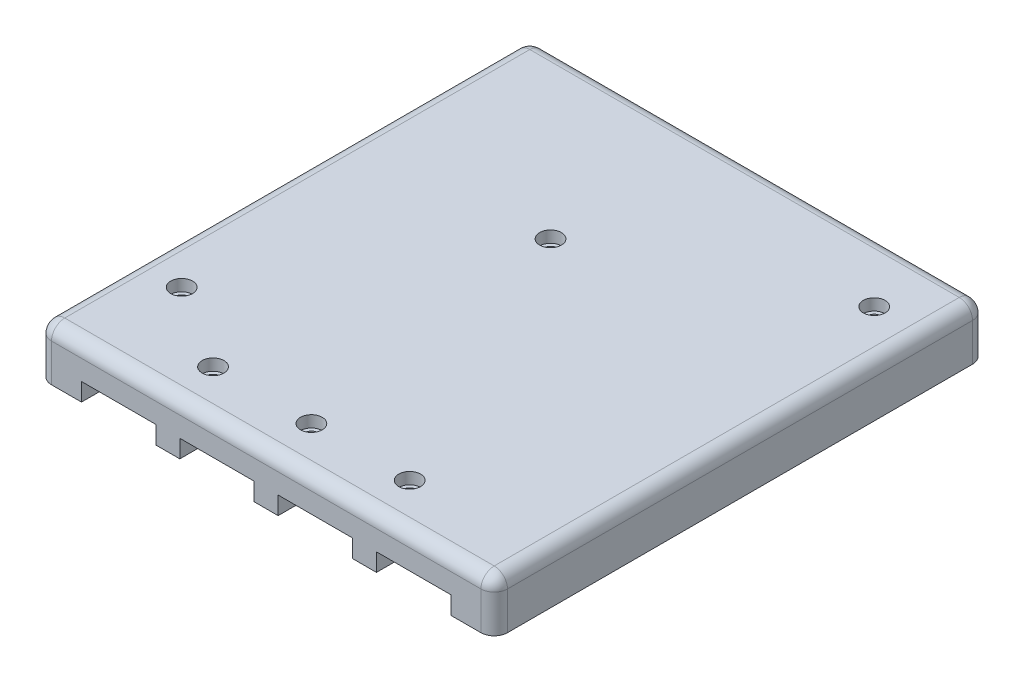
from build123d import *

# Parameters (mm, degrees)
SKETCH1_W           = 85.8
SKETCH1_H           = 92.5
SKETCH1_R           = 2.05
BOSS_EXTRUDE1_DEPTH = 3.175
SKETCH2_W           = 85.8
SKETCH2_H           = 92.5
SKETCH2_R           = 1.35
SKETCH2_R_2         = 3.35
BOSS_EXTRUDE2_DEPTH = 1.905
BOSS_EXTRUDE3_START = 1
SKETCH2_3_W         = 85.8
SKETCH2_3_H         = 92.5
SKETCH2_3_R         = 1.35
SKETCH2_3_R_2       = 3.35
BOSS_EXTRUDE3_DEPTH = 1
SKETCH3_W           = 85.8
SKETCH3_H           = 92.5
SKETCH3_W_2         = 75.8
SKETCH3_H_2         = 82.5
BOSS_EXTRUDE4_DEPTH = 4.55
SKETCH4_W           = 14
SKETCH4_H           = 6.75
CUT_EXTRUDE1_DEPTH  = 118.864146478
SKETCH5_W           = 10
SKETCH5_H           = 6
CUT_EXTRUDE2_DEPTH  = 118.864146478
BOSS_EXTRUDE5_DEPTH = 5
FILLET1_R           = 2.5
FILLET2_R           = 2.5
FILLET3_R           = 2.5
FILLET4_R           = 2.5
FILLET5_R           = 2.5


with BuildPart() as part:
    # Sketch1 → Boss-Extrude1 (new body)
    with BuildSketch(Plane(origin=(0, 0, 0), x_dir=(1, 0, 0), z_dir=(0, 1, 0))):
        with Locations((36.9, 40.25)):
            Rectangle(SKETCH1_W, SKETCH1_H)
        with Locations((2.5, 12.5)):
            Circle(SKETCH1_R, mode=Mode.SUBTRACT)
        with Locations((18.4, 2.5)):
            Circle(SKETCH1_R, mode=Mode.SUBTRACT)
        with Locations((36.9, 2.5)):
            Circle(SKETCH1_R, mode=Mode.SUBTRACT)
        with Locations((55.4, 2.5)):
            Circle(SKETCH1_R, mode=Mode.SUBTRACT)
        with Locations((29.3, 55.1)):
            Circle(SKETCH1_R, mode=Mode.SUBTRACT)
        with Locations((70.8, 74.5)):
            Circle(SKETCH1_R, mode=Mode.SUBTRACT)
    extrude(amount=BOSS_EXTRUDE1_DEPTH)

    # Sketch2 → Boss-Extrude2 (add)
    # profile 1 of 2: a face of its own
    with BuildSketch(Plane(origin=(0, 0, 0), x_dir=(1, 0, 0), z_dir=(0, 1, 0))):
        with Locations((36.9, 40.25)):
            Rectangle(SKETCH2_W, SKETCH2_H)
        with Locations((2.5, 12.5)):
            Circle(SKETCH2_R, mode=Mode.SUBTRACT)
        with Locations((18.4, 2.5)):
            Circle(SKETCH2_R, mode=Mode.SUBTRACT)
        with Locations((36.9, 2.5)):
            Circle(SKETCH2_R, mode=Mode.SUBTRACT)
        with Locations((55.4, 2.5)):
            Circle(SKETCH2_R, mode=Mode.SUBTRACT)
        with BuildLine():
            Line((-1, 7.5), (2.5, 7.5))
            ThreePointArc((2.5, 7.5), (7.5, 12.5), (2.5, 17.5))
            Line((2.5, 17.5), (-1, 17.5))
            Line((-1, 17.5), (-1, 81.5))
            Line((-1, 81.5), (65.8, 81.5))
            Line((65.8, 81.5), (65.8, 74.5))
            ThreePointArc((65.8, 74.5), (67.264466094, 70.964466094), (70.8, 69.5))
            Line((70.8, 69.5), (74.8, 69.5))
            Line((74.8, 69.5), (74.8, -1))
            Line((74.8, -1), (60.4, -1))
            Line((60.4, -1), (60.4, 2.5))
            ThreePointArc((60.4, 2.5), (55.4, 7.5), (50.4, 2.5))
            Line((50.4, 2.5), (50.4, -1))
            Line((50.4, -1), (41.9, -1))
            Line((41.9, -1), (41.9, 2.5))
            ThreePointArc((41.9, 2.5), (36.9, 7.5), (31.9, 2.5))
            Line((31.9, 2.5), (31.9, -1))
            Line((31.9, -1), (23.4, -1))
            Line((23.4, -1), (23.4, 2.5))
            ThreePointArc((23.4, 2.5), (18.4, 7.5), (13.4, 2.5))
            Line((13.4, 2.5), (13.4, -1))
            Line((13.4, -1), (-1, -1))
            Line((-1, -1), (-1, 7.5))
        make_face(mode=Mode.SUBTRACT)
        with Locations((70.8, 74.5)):
            Circle(SKETCH2_R, mode=Mode.SUBTRACT)
    # profile 2 of 2: a face of its own
    with BuildSketch(Plane(origin=(0, 0, 0), x_dir=(1, 0, 0), z_dir=(0, 1, 0))):
        with Locations((29.3, 55.1)):
            Circle(SKETCH2_R_2)
        with Locations((29.3, 55.1)):
            Circle(SKETCH2_R, mode=Mode.SUBTRACT)
    extrude(amount=-BOSS_EXTRUDE2_DEPTH)

    # Sketch2<3> → Boss-Extrude3 (add)
    # profile 1 of 2: a face of its own
    with BuildSketch(Plane(origin=(0, 0, 0), x_dir=(1, 0, 0), z_dir=(0, 1, 0)).offset(BOSS_EXTRUDE3_START)):
        with Locations((36.9, 40.25)):
            Rectangle(SKETCH2_3_W, SKETCH2_3_H)
        with Locations((2.5, 12.5)):
            Circle(SKETCH2_3_R, mode=Mode.SUBTRACT)
        with Locations((18.4, 2.5)):
            Circle(SKETCH2_3_R, mode=Mode.SUBTRACT)
        with Locations((36.9, 2.5)):
            Circle(SKETCH2_3_R, mode=Mode.SUBTRACT)
        with Locations((55.4, 2.5)):
            Circle(SKETCH2_3_R, mode=Mode.SUBTRACT)
        with BuildLine():
            Line((-1, 7.5), (2.5, 7.5))
            ThreePointArc((2.5, 7.5), (7.5, 12.5), (2.5, 17.5))
            Line((2.5, 17.5), (-1, 17.5))
            Line((-1, 17.5), (-1, 81.5))
            Line((-1, 81.5), (65.8, 81.5))
            Line((65.8, 81.5), (65.8, 74.5))
            ThreePointArc((65.8, 74.5), (67.264466094, 70.964466094), (70.8, 69.5))
            Line((70.8, 69.5), (74.8, 69.5))
            Line((74.8, 69.5), (74.8, -1))
            Line((74.8, -1), (60.4, -1))
            Line((60.4, -1), (60.4, 2.5))
            ThreePointArc((60.4, 2.5), (55.4, 7.5), (50.4, 2.5))
            Line((50.4, 2.5), (50.4, -1))
            Line((50.4, -1), (41.9, -1))
            Line((41.9, -1), (41.9, 2.5))
            ThreePointArc((41.9, 2.5), (36.9, 7.5), (31.9, 2.5))
            Line((31.9, 2.5), (31.9, -1))
            Line((31.9, -1), (23.4, -1))
            Line((23.4, -1), (23.4, 2.5))
            ThreePointArc((23.4, 2.5), (18.4, 7.5), (13.4, 2.5))
            Line((13.4, 2.5), (13.4, -1))
            Line((13.4, -1), (-1, -1))
            Line((-1, -1), (-1, 7.5))
        make_face(mode=Mode.SUBTRACT)
        with Locations((70.8, 74.5)):
            Circle(SKETCH2_3_R, mode=Mode.SUBTRACT)
    # profile 2 of 2: a face of its own
    with BuildSketch(Plane(origin=(0, 0, 0), x_dir=(1, 0, 0), z_dir=(0, 1, 0)).offset(BOSS_EXTRUDE3_START)):
        with Locations((29.3, 55.1)):
            Circle(SKETCH2_3_R_2)
        with Locations((29.3, 55.1)):
            Circle(SKETCH2_3_R, mode=Mode.SUBTRACT)
    extrude(amount=-BOSS_EXTRUDE3_DEPTH)

    # Sketch3 → Boss-Extrude4 (add)
    with BuildSketch(Plane(origin=(0, -1.905, 0), x_dir=(-1, 0, 0), z_dir=(0, -1, 0))):
        with Locations((-36.9, 40.25)):
            Rectangle(SKETCH3_W, SKETCH3_H)
        with Locations((-36.9, 40.25)):
            Rectangle(SKETCH3_W_2, SKETCH3_H_2, mode=Mode.SUBTRACT)
    extrude(amount=BOSS_EXTRUDE4_DEPTH)

    # Sketch4 → Cut-Extrude1 (cut, through all)
    with BuildSketch(Plane.XY):
        with Locations((9.15, -6.47)):
            Rectangle(SKETCH4_W, SKETCH4_H)
        with Locations((27.65, -6.47)):
            Rectangle(SKETCH4_W, SKETCH4_H)
        with Locations((46.15, -6.47)):
            Rectangle(SKETCH4_W, SKETCH4_H)
        with Locations((64.65, -6.47)):
            Rectangle(SKETCH4_W, SKETCH4_H)
    extrude(amount=CUT_EXTRUDE1_DEPTH, mode=Mode.SUBTRACT)

    # Sketch5 → Cut-Extrude2 (cut, through all)
    with BuildSketch(Plane.XY):
        with Locations((58, -7.455)):
            Rectangle(SKETCH5_W, SKETCH5_H)
    extrude(amount=-CUT_EXTRUDE2_DEPTH, mode=Mode.SUBTRACT)

    # Sketch6 → Boss-Extrude5 (add)
    with BuildSketch(Plane.ZY.offset(6)):
        with BuildLine():
            Line((-59.6, 0), (-59.6, -8.95))
            Line((-59.6, -8.95), (-59.131128874, -8.95))
            ThreePointArc((-59.131128874, -8.95), (-55.1, -6.45), (-51.068871126, -8.95))
            Line((-51.068871126, -8.95), (-50.6, -8.95))
            Line((-50.6, -8.95), (-50.6, 0))
            Line((-50.6, 0), (-59.6, 0))
        make_face()
    extrude(amount=-BOSS_EXTRUDE5_DEPTH)

    # Fillet1
    fillet1_edges = [part.edges().sort_by_distance(p)[0] for p in [
        (79.8, -1.64, 6),
    ]]
    fillet(fillet1_edges, radius=FILLET1_R)

    # Fillet2
    fillet2_edges = [part.edges().sort_by_distance(p)[0] for p in [
        (79.8, -1.64, -86.5),
    ]]
    fillet(fillet2_edges, radius=FILLET2_R)

    # Fillet3
    fillet3_edges = [part.edges().sort_by_distance(p)[0] for p in [
        (-6, -1.64, -86.5),
    ]]
    fillet(fillet3_edges, radius=FILLET3_R)

    # Fillet4
    fillet4_edges = [part.edges().sort_by_distance(p)[0] for p in [
        (-6, -1.64, 6),
    ]]
    fillet(fillet4_edges, radius=FILLET4_R)

    # Fillet5
    fillet5_edges = [part.edges().sort_by_distance(p)[0] for p in [
        (79.067766953, 3.175, -85.767766953),
        (79.8, 3.175, -40.25),
        (79.067766953, 3.175, 5.267766953),
        (36.9, 3.175, 6),
        (-5.267766953, 3.175, 5.267766953),
        (-6, 3.175, -40.25),
        (-5.267766953, 3.175, -85.767766953),
        (36.9, 3.175, -86.5),
    ]]
    fillet(fillet5_edges, radius=FILLET5_R)


solid = part.part
